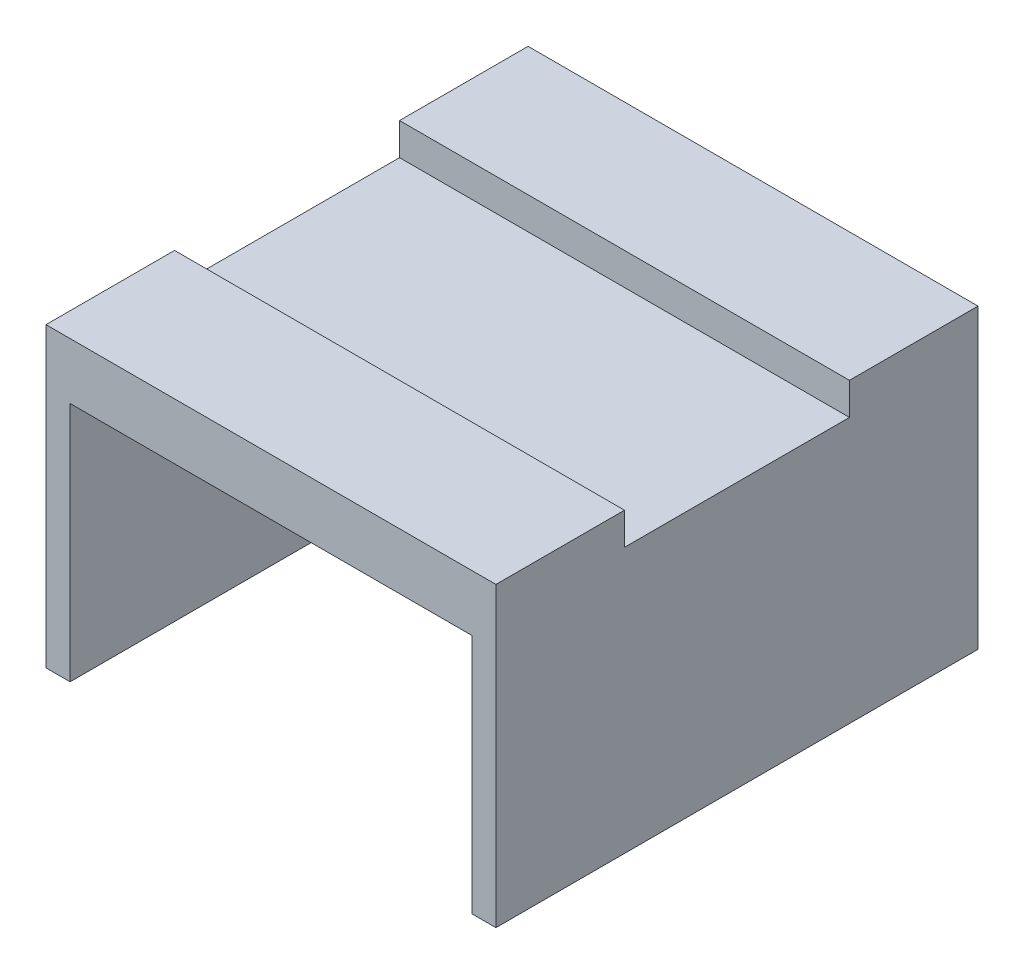
from build123d import *

# Parameters (mm, degrees)
SKETCH1_W             = 1.5
SKETCH1_H             = 30
BOSS_EXTRUDE1_DEPTH   = 15
BOSS_EXTRUDE1_2_DEPTH = 15
SKETCH4_W             = 28
SKETCH4_H             = 30
BOSS_EXTRUDE2_DEPTH   = 1.5
SKETCH5_W             = 28
SKETCH5_H             = 8
BOSS_EXTRUDE3_DEPTH   = 2


with BuildPart() as part:
    # Sketch1 → Boss-Extrude1 (new body)
    with BuildSketch(Plane(origin=(0, 0, 0), x_dir=(1, 0, 0), z_dir=(0, 1, 0))):
        with Locations((-12.224763407, -7.389589905)):
            Rectangle(SKETCH1_W, SKETCH1_H)
    extrude(amount=BOSS_EXTRUDE1_DEPTH)



with BuildPart() as body_2:
    # Sketch1 → Boss-Extrude1 2 (new body)
    with BuildSketch(Plane(origin=(0, 0, 0), x_dir=(1, 0, 0), z_dir=(0, 1, 0))):
        with Locations((14.275236593, -7.389589905)):
            Rectangle(SKETCH1_W, SKETCH1_H)
    extrude(amount=BOSS_EXTRUDE1_2_DEPTH)


with BuildPart() as part_1:
    add(part.part)

    add(body_2.part)  # Boss-Extrude2 merges body 2
    # Sketch4 → Boss-Extrude2 (add)
    with BuildSketch(Plane(origin=(0, 15, 0), x_dir=(1, 0, 0), z_dir=(0, 1, 0))):
        with Locations((1.025236593, -7.389589905)):
            Rectangle(SKETCH4_W, SKETCH4_H)
    extrude(amount=BOSS_EXTRUDE2_DEPTH)

    # Sketch5 → Boss-Extrude3 (add)
    with BuildSketch(Plane(origin=(0, 16.5, 0), x_dir=(1, 0, 0), z_dir=(0, 1, 0))):
        with Locations((1.025236593, 3.610410095)):
            Rectangle(SKETCH5_W, SKETCH5_H)
        with Locations((1.025236593, -18.389589905)):
            Rectangle(SKETCH5_W, SKETCH5_H)
    extrude(amount=BOSS_EXTRUDE3_DEPTH)


solid = part_1.part
